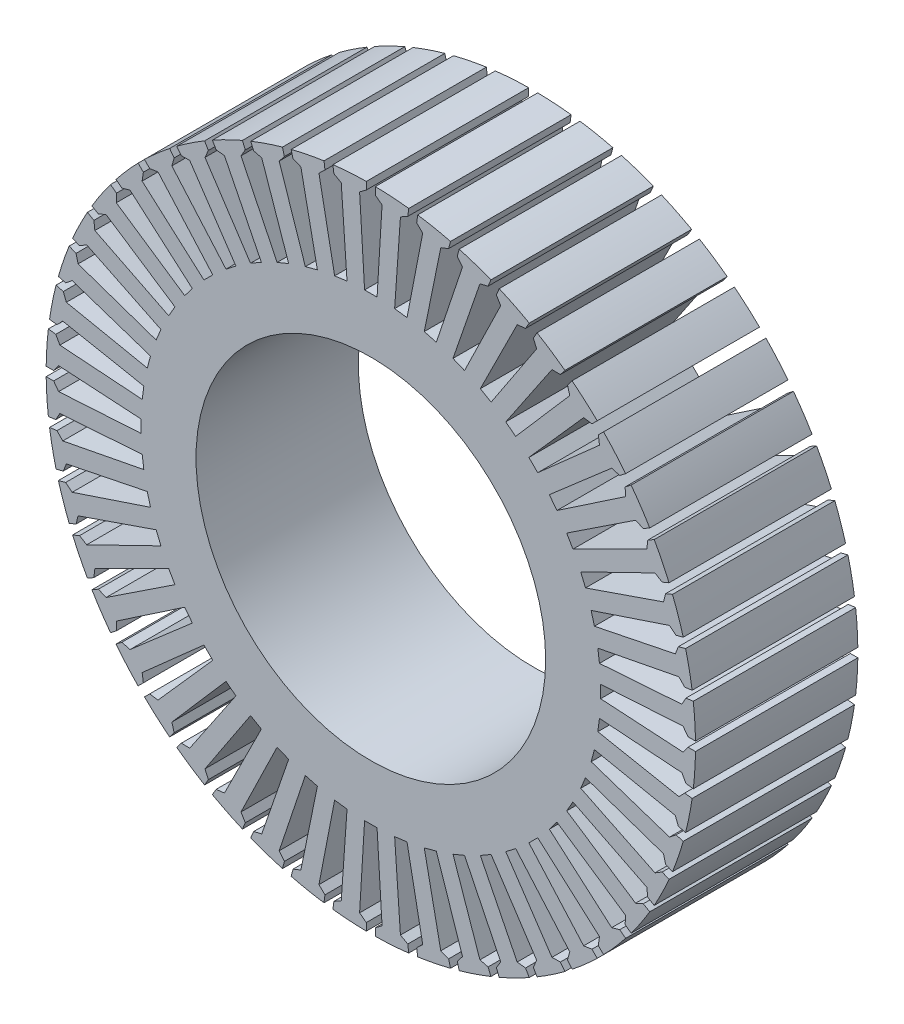
from build123d import *

# Parameters (mm, degrees)
STATOR_STACK_START    = -15
SKETCH_1_R            = 60
SKETCH_1_R_2          = 32.307692308
STATOR_STACK_DEPTH    = 30
STATOR_48_SLOTS_DEPTH = 16


with BuildPart() as part:
    # Эскиз1 → Stator_stack (new body)
    with BuildSketch(Plane.XY.offset(STATOR_STACK_START)):
        Circle(SKETCH_1_R)
        Circle(SKETCH_1_R_2, mode=Mode.SUBTRACT)
    extrude(amount=STATOR_STACK_DEPTH)

    # Эскиз2 → Stator_48_slots (cut, symmetric)
    with BuildSketch(Plane.XY):
        Polygon((60.994342545, -0.830769231), (58.615384615, -0.830769231), (57.692307692, -2.076923077), (42.461538462, -1.153846154), (42.461538462, 1.153846154), (57.692307692, 2.076923077), (58.615384615, 0.830769231), (60.994342545, 0.830769231), align=None)
        Polygon((60.580964633, 7.137697395), (58.222359019, 6.827181075), (57.469834863, 5.471202531), (42.248881259, 4.398368091), (41.947666969, 6.686317771), (56.927649142, 9.589511956), (58.00548473, 8.474504844), (60.364090345, 8.785021164), align=None)
        Polygon((59.131029621, 14.984036038), (56.833132717, 14.368316419), (56.264037226, 12.925714347), (41.313333984, 9.875325039), (40.716059264, 12.104384638), (55.188942731, 16.938021626), (56.403094919, 15.97323933), (58.700991823, 16.58895895), align=None)
        Polygon((56.669346297, 22.573993671), (54.471475757, 21.663605885), (54.095546312, 20.159063607), (39.67090411, 15.183312437), (38.787788497, 17.315342127), (52.505938208, 23.99671705), (53.835632516, 23.198667263), (56.033503055, 24.109055048), align=None)
        Polygon((53.238034746, 29.777704014), (51.177796745, 28.588225049), (51.001465603, 27.0474857), (37.349694068, 20.231509149), (36.195847915, 22.230029312), (48.924542526, 30.644821992), (50.347027514, 30.027159566), (52.407265516, 31.216638531), align=None)
        Polygon((48.895805661, 36.471909585), (47.008451441, 35.023691756), (47.034735677, 33.473117813), (34.389420406, 24.933539131), (32.984586339, 26.764354532), (44.506034357, 36.768585534), (45.996970913, 36.341878845), (47.884325133, 37.790096673), align=None)
        Polygon((43.716955784, 42.542070671), (42.0347785, 40.859893387), (42.263228383, 39.3260156), (30.840734226, 29.208949346), (29.208949346, 30.840734226), (39.3260156, 42.263228383), (40.859893387, 42.0347785), (42.542070671, 43.716955784), align=None)
        Polygon((37.790096673, 47.884325133), (36.341878845, 45.996970913), (36.768585534, 44.506034357), (26.764354532, 32.984586339), (24.933539131, 34.389420406), (33.473117813, 47.034735677), (35.023691756, 47.008451441), (36.471909585, 48.895805661), align=None)
        Polygon((31.216638531, 52.407265516), (30.027159566, 50.347027514), (30.644821992, 48.924542526), (22.230029312, 36.195847915), (20.231509149, 37.349694068), (27.0474857, 51.001465603), (28.588225049, 51.177796745), (29.777704014, 53.238034746), align=None)
        Polygon((24.109055048, 56.033503055), (23.198667263, 53.835632516), (23.99671705, 52.505938208), (17.315342127, 38.787788497), (15.183312437, 39.67090411), (20.159063607, 54.095546312), (21.663605885, 54.471475757), (22.573993671, 56.669346297), align=None)
        Polygon((16.58895895, 58.700991823), (15.97323933, 56.403094919), (16.938021626, 55.188942731), (12.104384638, 40.716059264), (9.875325039, 41.313333984), (12.925714347, 56.264037226), (14.368316419, 56.833132717), (14.984036038, 59.131029621), align=None)
        Polygon((8.785021164, 60.364090345), (8.474504844, 58.00548473), (9.589511956, 56.927649142), (6.686317771, 41.947666969), (4.398368091, 42.248881259), (5.471202531, 57.469834863), (6.827181075, 58.222359019), (7.137697395, 60.580964633), align=None)
        Polygon((0.830769231, 60.994342545), (0.830769231, 58.615384615), (2.076923077, 57.692307692), (1.153846154, 42.461538462), (-1.153846154, 42.461538462), (-2.076923077, 57.692307692), (-0.830769231, 58.615384615), (-0.830769231, 60.994342545), align=None)
        Polygon((-7.137697395, 60.580964633), (-6.827181075, 58.222359019), (-5.471202531, 57.469834863), (-4.398368091, 42.248881259), (-6.686317771, 41.947666969), (-9.589511956, 56.927649142), (-8.474504844, 58.00548473), (-8.785021164, 60.364090345), align=None)
        Polygon((-14.984036038, 59.131029621), (-14.368316419, 56.833132717), (-12.925714347, 56.264037226), (-9.875325039, 41.313333984), (-12.104384638, 40.716059264), (-16.938021626, 55.188942731), (-15.97323933, 56.403094919), (-16.58895895, 58.700991823), align=None)
        Polygon((-22.573993671, 56.669346297), (-21.663605885, 54.471475757), (-20.159063607, 54.095546312), (-15.183312437, 39.67090411), (-17.315342127, 38.787788497), (-23.99671705, 52.505938208), (-23.198667263, 53.835632516), (-24.109055048, 56.033503055), align=None)
        Polygon((-29.777704014, 53.238034746), (-28.588225049, 51.177796745), (-27.0474857, 51.001465603), (-20.231509149, 37.349694068), (-22.230029312, 36.195847915), (-30.644821992, 48.924542526), (-30.027159566, 50.347027514), (-31.216638531, 52.407265516), align=None)
        Polygon((-36.471909585, 48.895805661), (-35.023691756, 47.008451441), (-33.473117813, 47.034735677), (-24.933539131, 34.389420406), (-26.764354532, 32.984586339), (-36.768585534, 44.506034357), (-36.341878845, 45.996970913), (-37.790096673, 47.884325133), align=None)
        Polygon((-42.542070671, 43.716955784), (-40.859893387, 42.0347785), (-39.3260156, 42.263228383), (-29.208949346, 30.840734226), (-30.840734226, 29.208949346), (-42.263228383, 39.3260156), (-42.0347785, 40.859893387), (-43.716955784, 42.542070671), align=None)
        Polygon((-47.884325133, 37.790096673), (-45.996970913, 36.341878845), (-44.506034357, 36.768585534), (-32.984586339, 26.764354532), (-34.389420406, 24.933539131), (-47.034735677, 33.473117813), (-47.008451441, 35.023691756), (-48.895805661, 36.471909585), align=None)
        Polygon((-52.407265516, 31.216638531), (-50.347027514, 30.027159566), (-48.924542526, 30.644821992), (-36.195847915, 22.230029312), (-37.349694068, 20.231509149), (-51.001465603, 27.0474857), (-51.177796745, 28.588225049), (-53.238034746, 29.777704014), align=None)
        Polygon((-56.033503055, 24.109055048), (-53.835632516, 23.198667263), (-52.505938208, 23.99671705), (-38.787788497, 17.315342127), (-39.67090411, 15.183312437), (-54.095546312, 20.159063607), (-54.471475757, 21.663605885), (-56.669346297, 22.573993671), align=None)
        Polygon((-58.700991823, 16.58895895), (-56.403094919, 15.97323933), (-55.188942731, 16.938021626), (-40.716059264, 12.104384638), (-41.313333984, 9.875325039), (-56.264037226, 12.925714347), (-56.833132717, 14.368316419), (-59.131029621, 14.984036038), align=None)
        Polygon((-60.364090345, 8.785021164), (-58.00548473, 8.474504844), (-56.927649142, 9.589511956), (-41.947666969, 6.686317771), (-42.248881259, 4.398368091), (-57.469834863, 5.471202531), (-58.222359019, 6.827181075), (-60.580964633, 7.137697395), align=None)
        Polygon((-60.994342545, 0.830769231), (-58.615384615, 0.830769231), (-57.692307692, 2.076923077), (-42.461538462, 1.153846154), (-42.461538462, -1.153846154), (-57.692307692, -2.076923077), (-58.615384615, -0.830769231), (-60.994342545, -0.830769231), align=None)
        Polygon((-60.580964633, -7.137697395), (-58.222359019, -6.827181075), (-57.469834863, -5.471202531), (-42.248881259, -4.398368091), (-41.947666969, -6.686317771), (-56.927649142, -9.589511956), (-58.00548473, -8.474504844), (-60.364090345, -8.785021164), align=None)
        Polygon((-59.131029621, -14.984036038), (-56.833132717, -14.368316419), (-56.264037226, -12.925714347), (-41.313333984, -9.875325039), (-40.716059264, -12.104384638), (-55.188942731, -16.938021626), (-56.403094919, -15.97323933), (-58.700991823, -16.58895895), align=None)
        Polygon((-56.669346297, -22.573993671), (-54.471475757, -21.663605885), (-54.095546312, -20.159063607), (-39.67090411, -15.183312437), (-38.787788497, -17.315342127), (-52.505938208, -23.99671705), (-53.835632516, -23.198667263), (-56.033503055, -24.109055048), align=None)
        Polygon((-53.238034746, -29.777704014), (-51.177796745, -28.588225049), (-51.001465603, -27.0474857), (-37.349694068, -20.231509149), (-36.195847915, -22.230029312), (-48.924542526, -30.644821992), (-50.347027514, -30.027159566), (-52.407265516, -31.216638531), align=None)
        Polygon((-48.895805661, -36.471909585), (-47.008451441, -35.023691756), (-47.034735677, -33.473117813), (-34.389420406, -24.933539131), (-32.984586339, -26.764354532), (-44.506034357, -36.768585534), (-45.996970913, -36.341878845), (-47.884325133, -37.790096673), align=None)
        Polygon((-43.716955784, -42.542070671), (-42.0347785, -40.859893387), (-42.263228383, -39.3260156), (-30.840734226, -29.208949346), (-29.208949346, -30.840734226), (-39.3260156, -42.263228383), (-40.859893387, -42.0347785), (-42.542070671, -43.716955784), align=None)
        Polygon((-37.790096673, -47.884325133), (-36.341878845, -45.996970913), (-36.768585534, -44.506034357), (-26.764354532, -32.984586339), (-24.933539131, -34.389420406), (-33.473117813, -47.034735677), (-35.023691756, -47.008451441), (-36.471909585, -48.895805661), align=None)
        Polygon((-31.216638531, -52.407265516), (-30.027159566, -50.347027514), (-30.644821992, -48.924542526), (-22.230029312, -36.195847915), (-20.231509149, -37.349694068), (-27.0474857, -51.001465603), (-28.588225049, -51.177796745), (-29.777704014, -53.238034746), align=None)
        Polygon((-24.109055048, -56.033503055), (-23.198667263, -53.835632516), (-23.99671705, -52.505938208), (-17.315342127, -38.787788497), (-15.183312437, -39.67090411), (-20.159063607, -54.095546312), (-21.663605885, -54.471475757), (-22.573993671, -56.669346297), align=None)
        Polygon((-16.58895895, -58.700991823), (-15.97323933, -56.403094919), (-16.938021626, -55.188942731), (-12.104384638, -40.716059264), (-9.875325039, -41.313333984), (-12.925714347, -56.264037226), (-14.368316419, -56.833132717), (-14.984036038, -59.131029621), align=None)
        Polygon((-8.785021164, -60.364090345), (-8.474504844, -58.00548473), (-9.589511956, -56.927649142), (-6.686317771, -41.947666969), (-4.398368091, -42.248881259), (-5.471202531, -57.469834863), (-6.827181075, -58.222359019), (-7.137697395, -60.580964633), align=None)
        Polygon((-0.830769231, -60.994342545), (-0.830769231, -58.615384615), (-2.076923077, -57.692307692), (-1.153846154, -42.461538462), (1.153846154, -42.461538462), (2.076923077, -57.692307692), (0.830769231, -58.615384615), (0.830769231, -60.994342545), align=None)
        Polygon((7.137697395, -60.580964633), (6.827181075, -58.222359019), (5.471202531, -57.469834863), (4.398368091, -42.248881259), (6.686317771, -41.947666969), (9.589511956, -56.927649142), (8.474504844, -58.00548473), (8.785021164, -60.364090345), align=None)
        Polygon((14.984036038, -59.131029621), (14.368316419, -56.833132717), (12.925714347, -56.264037226), (9.875325039, -41.313333984), (12.104384638, -40.716059264), (16.938021626, -55.188942731), (15.97323933, -56.403094919), (16.58895895, -58.700991823), align=None)
        Polygon((22.573993671, -56.669346297), (21.663605885, -54.471475757), (20.159063607, -54.095546312), (15.183312437, -39.67090411), (17.315342127, -38.787788497), (23.99671705, -52.505938208), (23.198667263, -53.835632516), (24.109055048, -56.033503055), align=None)
        Polygon((29.777704014, -53.238034746), (28.588225049, -51.177796745), (27.0474857, -51.001465603), (20.231509149, -37.349694068), (22.230029312, -36.195847915), (30.644821992, -48.924542526), (30.027159566, -50.347027514), (31.216638531, -52.407265516), align=None)
        Polygon((36.471909585, -48.895805661), (35.023691756, -47.008451441), (33.473117813, -47.034735677), (24.933539131, -34.389420406), (26.764354532, -32.984586339), (36.768585534, -44.506034357), (36.341878845, -45.996970913), (37.790096673, -47.884325133), align=None)
        Polygon((42.542070671, -43.716955784), (40.859893387, -42.0347785), (39.3260156, -42.263228383), (29.208949346, -30.840734226), (30.840734226, -29.208949346), (42.263228383, -39.3260156), (42.0347785, -40.859893387), (43.716955784, -42.542070671), align=None)
        Polygon((47.884325133, -37.790096673), (45.996970913, -36.341878845), (44.506034357, -36.768585534), (32.984586339, -26.764354532), (34.389420406, -24.933539131), (47.034735677, -33.473117813), (47.008451441, -35.023691756), (48.895805661, -36.471909585), align=None)
        Polygon((52.407265516, -31.216638531), (50.347027514, -30.027159566), (48.924542526, -30.644821992), (36.195847915, -22.230029312), (37.349694068, -20.231509149), (51.001465603, -27.0474857), (51.177796745, -28.588225049), (53.238034746, -29.777704014), align=None)
        Polygon((56.033503055, -24.109055048), (53.835632516, -23.198667263), (52.505938208, -23.99671705), (38.787788497, -17.315342127), (39.67090411, -15.183312437), (54.095546312, -20.159063607), (54.471475757, -21.663605885), (56.669346297, -22.573993671), align=None)
        Polygon((58.700991823, -16.58895895), (56.403094919, -15.97323933), (55.188942731, -16.938021626), (40.716059264, -12.104384638), (41.313333984, -9.875325039), (56.264037226, -12.925714347), (56.833132717, -14.368316419), (59.131029621, -14.984036038), align=None)
        Polygon((60.364090345, -8.785021164), (58.00548473, -8.474504844), (56.927649142, -9.589511956), (41.947666969, -6.686317771), (42.248881259, -4.398368091), (57.469834863, -5.471202531), (58.222359019, -6.827181075), (60.580964633, -7.137697395), align=None)
    extrude(amount=STATOR_48_SLOTS_DEPTH, both=True, mode=Mode.SUBTRACT)


solid = part.part
